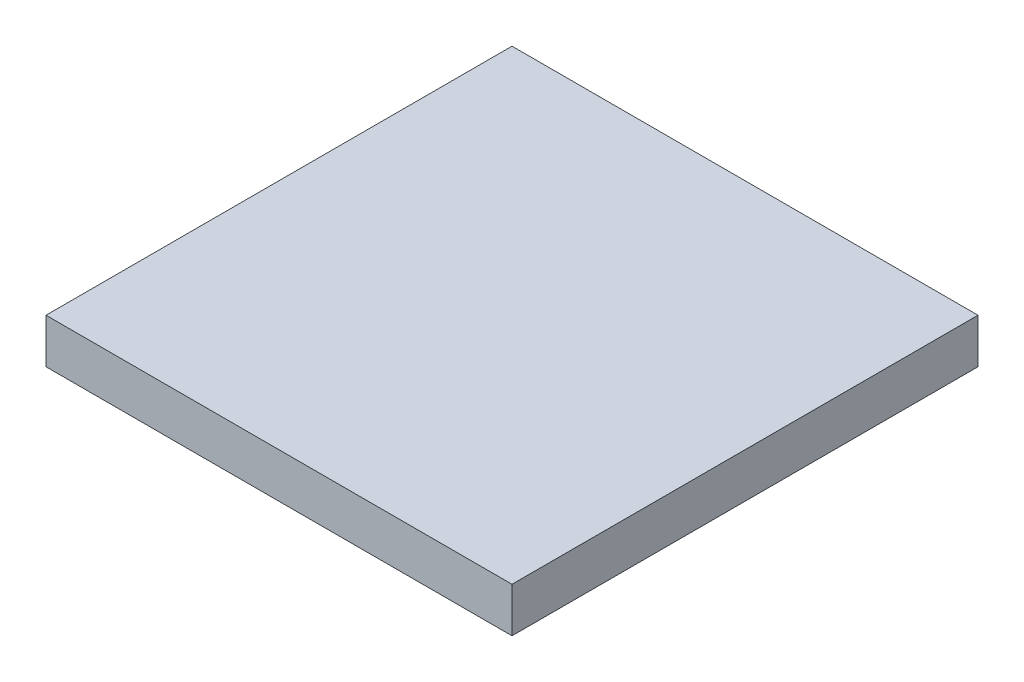
from build123d import *

# Parameters (mm, degrees)
SKETCH1_W           = 190.5
SKETCH1_H           = 190.5
BOSS_EXTRUDE1_DEPTH = 18.25625


with BuildPart() as part:
    # Sketch1 → Boss-Extrude1 (new body)
    with BuildSketch(Plane(origin=(0, 0, 0), x_dir=(1, 0, 0), z_dir=(0, 1, 0))):
        Rectangle(SKETCH1_W, SKETCH1_H)
    extrude(amount=BOSS_EXTRUDE1_DEPTH)


solid = part.part
